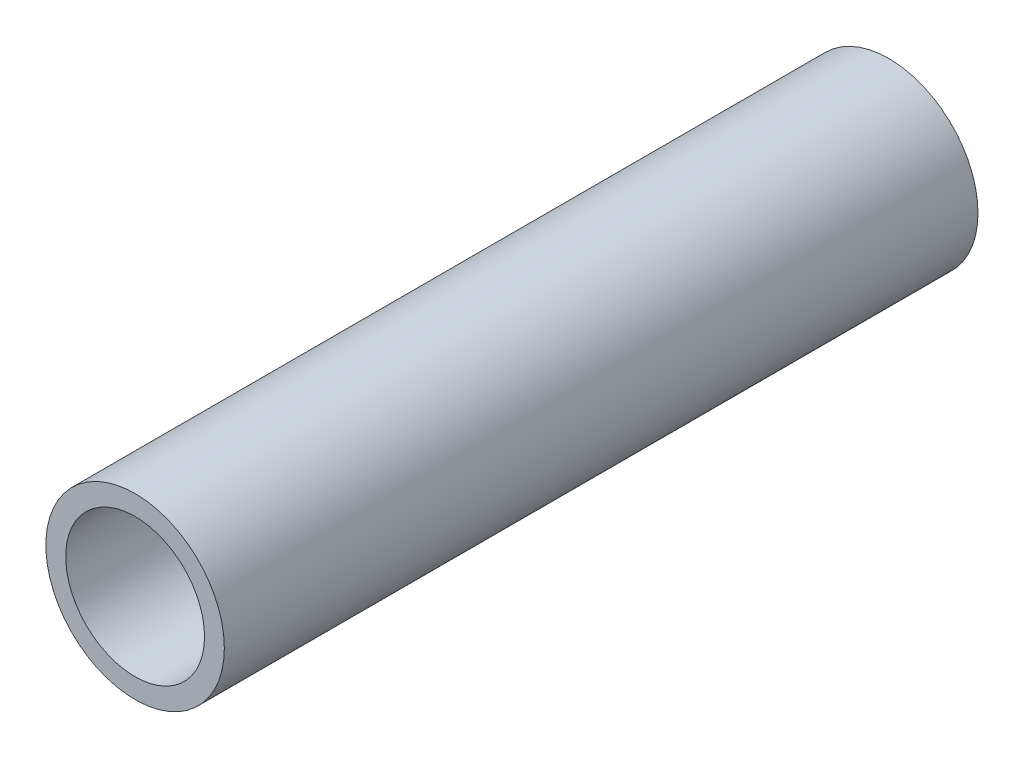
from build123d import *

# Parameters (mm, degrees)
SKETCH_1_R      = 9
SKETCH_1_R_2    = 7
EXTRUDE_1_DEPTH = 76


with BuildPart() as part:
    # 草图1 → 凸台-拉伸1 (new body)
    with BuildSketch(Plane.XY):
        Circle(SKETCH_1_R)
        Circle(SKETCH_1_R_2, mode=Mode.SUBTRACT)
    extrude(amount=EXTRUDE_1_DEPTH)


solid = part.part
